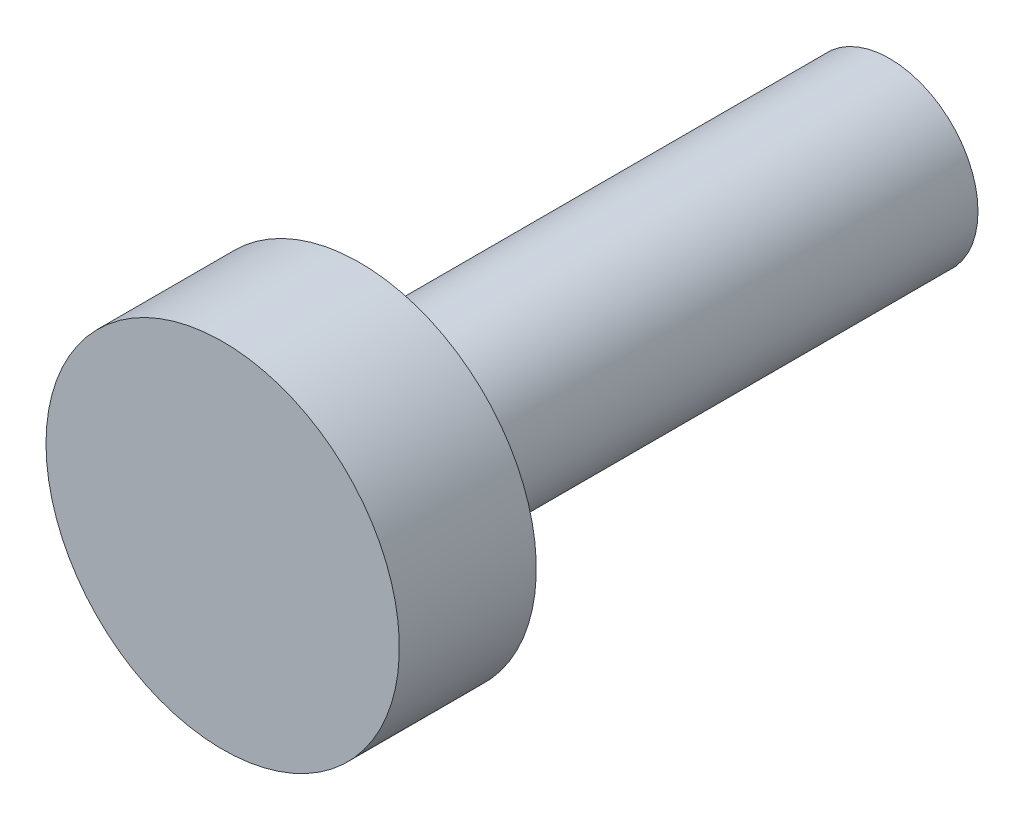
from build123d import *

# Parameters (mm, degrees)
ESQUISSE1_R        = 4
BOSS_EXTRU_1_DEPTH = 3.1
ESQUISSE2_R        = 2
BOSS_EXTRU_2_DEPTH = 12


with BuildPart() as part:
    # Esquisse1 → Boss.-Extru.1 (new body)
    with BuildSketch(Plane.XY):
        with Locations(Location((0, 0, 0), (0, 0, 180))):
            Circle(ESQUISSE1_R)
    extrude(amount=BOSS_EXTRU_1_DEPTH)

    # Esquisse2 → Boss.-Extru.2 (add)
    with BuildSketch(Plane(origin=(0, 0, 0), x_dir=(-1, 0, 0), z_dir=(0, 0, -1))):
        Circle(ESQUISSE2_R)
    extrude(amount=BOSS_EXTRU_2_DEPTH)


solid = part.part
